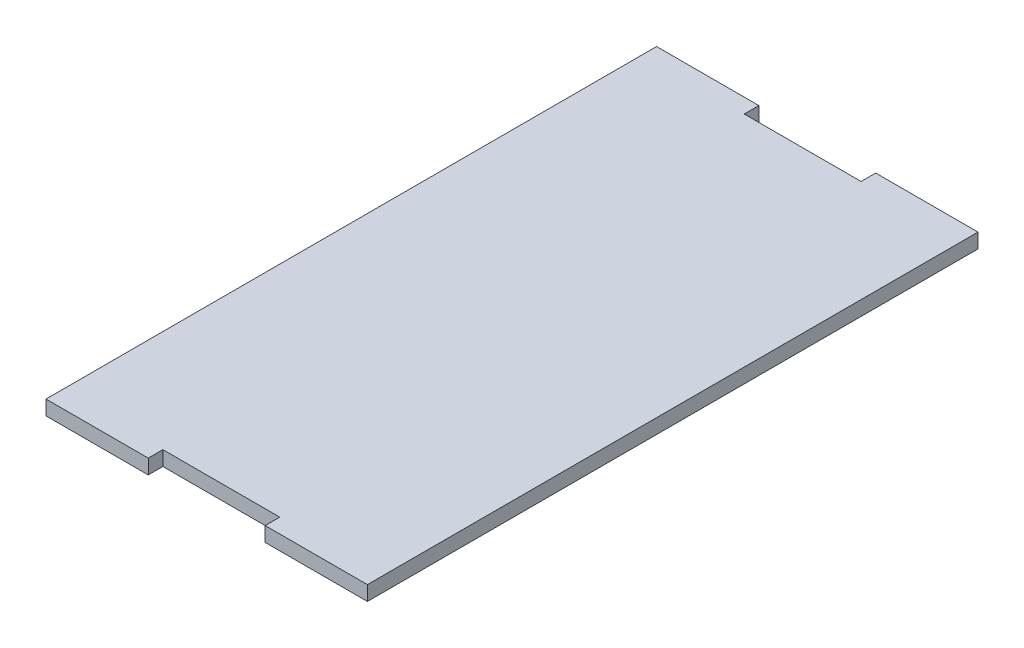
from build123d import *

# Parameters (mm, degrees)
SKETCH5_W           = 395.4
SKETCH5_H           = 265.4
BOSS_EXTRUDE3_DEPTH = 6.35
SKETCH6_W           = 78.175
SKETCH6_H           = 243.175
SKETCH6_W_2         = 75
SKETCH6_H_2         = 240
CUT_EXTRUDE1_DEPTH  = 6.35
SKETCH10_W          = 6.35
SKETCH10_H          = 50.8
SKETCH10_W_2        = 50.8
SKETCH10_H_2        = 6.35
CUT_EXTRUDE2_DEPTH  = 6.35
SKETCH11_W          = 50.8
SKETCH11_H          = 6.35
CUT_EXTRUDE3_DEPTH  = 6.35
SKETCH12_W          = 78.175
SKETCH12_H          = 4.7625
BOSS_EXTRUDE4_DEPTH = 6.35
FILLET1_R           = 3.175
CUT_EXTRUDE4_DEPTH  = 239.190895082


with BuildPart() as part:
    # Sketch5 → Boss-Extrude3 (new body)
    with BuildSketch(Plane(origin=(0, 0, 0), x_dir=(1, 0, 0), z_dir=(0, 1, 0))):
        Rectangle(SKETCH5_W, SKETCH5_H)
    extrude(amount=BOSS_EXTRUDE3_DEPTH)

    # Sketch6 → Cut-Extrude1 (cut)
    # profile 1 of 4: a face of its own
    with BuildSketch(Plane(origin=(0, 6.35, 0), x_dir=(1, 0, 0), z_dir=(0, 1, 0))):
        with Locations((147.5, 0)):
            Rectangle(SKETCH6_W, SKETCH6_H)
        with Locations((147.5, 0)):
            Rectangle(SKETCH6_W_2, SKETCH6_H_2, mode=Mode.SUBTRACT)
    # profile 2 of 4: a face of its own
    with BuildSketch(Plane(origin=(0, 6.35, 0), x_dir=(1, 0, 0), z_dir=(0, 1, 0))):
        with Locations((147.5, 0)):
            Rectangle(SKETCH6_W_2, SKETCH6_H_2)
    # profile 3 of 4: a face of its own
    with BuildSketch(Plane(origin=(0, 6.35, 0), x_dir=(1, 0, 0), z_dir=(0, 1, 0))):
        with Locations((-147.5, 0)):
            Rectangle(SKETCH6_W, SKETCH6_H)
        with Locations((-147.5, 0)):
            Rectangle(SKETCH6_W_2, SKETCH6_H_2, mode=Mode.SUBTRACT)
    # profile 4 of 4: a face of its own
    with BuildSketch(Plane(origin=(0, 6.35, 0), x_dir=(1, 0, 0), z_dir=(0, 1, 0))):
        with Locations((-147.5, 0)):
            Rectangle(SKETCH6_W_2, SKETCH6_H_2)
    extrude(amount=-CUT_EXTRUDE1_DEPTH, mode=Mode.SUBTRACT)

    # Sketch10 → Cut-Extrude2 (cut)
    with BuildSketch(Plane.XZ):
        with Locations((98.8875, -63.5)):
            Rectangle(SKETCH10_W, SKETCH10_H)
        with Locations((98.8875, 63.5)):
            Rectangle(SKETCH10_W, SKETCH10_H)
        with Locations((-98.8875, 63.5)):
            Rectangle(SKETCH10_W, SKETCH10_H)
        with Locations((-98.8875, -63.5)):
            Rectangle(SKETCH10_W, SKETCH10_H)
        Polygon((197.7, 132.7), (177.8, 132.7), (177.8, 126.35), (191.35, 126.35), (197.7, 126.35), align=None)
        Polygon((127, 132.7), (76.2, 132.7), (76.2, 126.35), (95.7125, 126.35), (102.0625, 126.35), (108.4125, 126.35), (127, 126.35), align=None)
        with Locations((0, 129.525)):
            Rectangle(SKETCH10_W_2, SKETCH10_H_2)
        Polygon((-127, 132.7), (-127, 126.35), (-108.4125, 126.35), (-102.0625, 126.35), (-95.7125, 126.35), (-76.2, 126.35), (-76.2, 132.7), align=None)
        Polygon((-197.7, 126.35), (-191.35, 126.35), (-177.8, 126.35), (-177.8, 132.7), (-197.7, 132.7), align=None)
        Polygon((-177.8, -126.35), (-191.35, -126.35), (-197.7, -126.35), (-197.7, -132.7), (-177.8, -132.7), align=None)
        Polygon((-108.4125, -126.35), (-127, -126.35), (-127, -132.7), (-76.2, -132.7), (-76.2, -126.35), (-95.7125, -126.35), (-102.0625, -126.35), align=None)
        with Locations((0, -129.525)):
            Rectangle(SKETCH10_W_2, SKETCH10_H_2)
        Polygon((76.2, -126.35), (76.2, -132.7), (127, -132.7), (127, -126.35), (108.4125, -126.35), (102.0625, -126.35), (95.7125, -126.35), align=None)
        Polygon((177.8, -126.35), (177.8, -132.7), (197.7, -132.7), (197.7, -126.35), (191.35, -126.35), align=None)
    extrude(amount=-CUT_EXTRUDE2_DEPTH, mode=Mode.SUBTRACT)

    # Sketch11 → Cut-Extrude3 (cut)
    with BuildSketch(Plane(origin=(197.7, 0, 0), x_dir=(0, 0, -1), z_dir=(1, 0, 0))):
        with Locations((-63.5, 3.175)):
            Rectangle(SKETCH11_W, SKETCH11_H)
        with Locations((63.5, 3.175)):
            Rectangle(SKETCH11_W, SKETCH11_H)
    cut_extrude3 = extrude(amount=-CUT_EXTRUDE3_DEPTH, mode=Mode.SUBTRACT)

    # Mirror1: Cut-Extrude3 across plane
    add(cut_extrude3.mirror(Plane(origin=(0, 0, 0), x_dir=(0, 0, 1), z_dir=(1, 0, 0))), mode=Mode.SUBTRACT)

    # Sketch12 → Boss-Extrude4 (add)
    with BuildSketch(Plane.XZ):
        with Locations((147.5, -119.20625)):
            Rectangle(SKETCH12_W, SKETCH12_H)
        with Locations((147.5, 119.20625)):
            Rectangle(SKETCH12_W, SKETCH12_H)
        with Locations((-147.5, 119.20625)):
            Rectangle(SKETCH12_W, SKETCH12_H)
        with Locations((-147.5, -119.20625)):
            Rectangle(SKETCH12_W, SKETCH12_H)
    extrude(amount=-BOSS_EXTRUDE4_DEPTH)

    # Fillet1
    fillet1_edges = [part.edges().sort_by_distance(p)[0] for p in [
        (108.4125, 3.175, -116.825),
        (186.5875, 3.175, -116.825),
        (186.5875, 3.175, 116.825),
        (108.4125, 3.175, 116.825),
        (-186.5875, 3.175, 116.825),
        (-108.4125, 3.175, 116.825),
        (-108.4125, 3.175, -116.825),
        (-186.5875, 3.175, -116.825),
    ]]
    fillet(fillet1_edges, radius=FILLET1_R)

    # Sketch13 → Cut-Extrude4 (cut, through all)
    with BuildSketch(Plane.XZ):
        Polygon((69.85, 132.7), (69.85, -132.7), (76.2, -132.7), (76.2, -126.35), (127, -126.35), (127, -132.7), (177.8, -132.7), (177.8, -126.35), (197.7, -126.35), (197.7, -88.9), (191.35, -88.9), (191.35, -38.1), (197.7, -38.1), (197.7, 38.1), (191.35, 38.1), (191.35, 88.9), (197.7, 88.9), (197.7, 126.35), (177.8, 126.35), (177.8, 132.7), (127, 132.7), (127, 126.35), (76.2, 126.35), (76.2, 132.7), align=None)
        Polygon((-76.2, -132.7), (-69.85, -132.7), (-69.85, 132.7), (-76.2, 132.7), (-76.2, 126.35), (-127, 126.35), (-127, 132.7), (-177.8, 132.7), (-177.8, 126.35), (-197.7, 126.35), (-197.7, 88.9), (-191.35, 88.9), (-191.35, 38.1), (-197.7, 38.1), (-197.7, -38.1), (-191.35, -38.1), (-191.35, -88.9), (-197.7, -88.9), (-197.7, -126.35), (-177.8, -126.35), (-177.8, -132.7), (-127, -132.7), (-127, -126.35), (-76.2, -126.35), align=None)
    extrude(amount=-CUT_EXTRUDE4_DEPTH, mode=Mode.SUBTRACT)


solid = part.part
